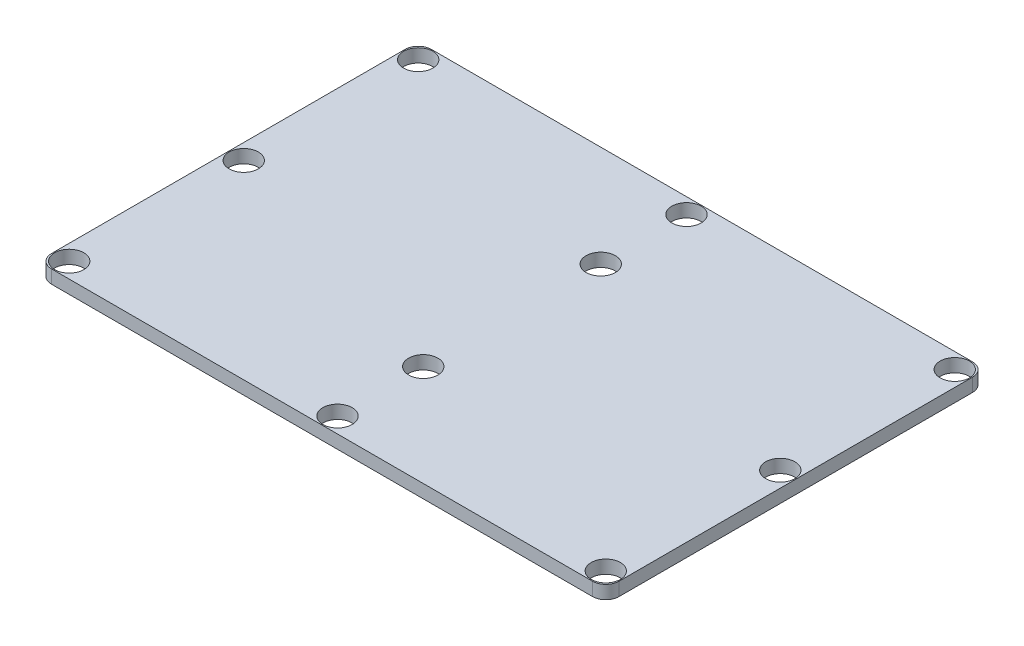
from build123d import *

# Parameters (mm, degrees)
SKETCH1_W            = 128
SKETCH1_H            = 85.7
BOSS_EXTRUDE1_DEPTH  = 3
M6_CLEARANCE_HOLE1_D = 6.6
FILLET1_R            = 3


with BuildPart() as part:
    # Sketch1 → Boss-Extrude1 (new body)
    with BuildSketch(Plane(origin=(0, 0, 0), x_dir=(1, 0, 0), z_dir=(0, 1, 0))):
        Rectangle(SKETCH1_W, SKETCH1_H)
    extrude(amount=BOSS_EXTRUDE1_DEPTH)

    # M6 Clearance Hole1 (through all)
    with Locations(Plane(origin=(0, 3, 0), x_dir=(1, 0, 0), z_dir=(0, 1, 0))):
        with Locations((-60.5, 39.35), (0, 39.35), (60.5, 39.35), (60.5, 0), (60.5, -39.35), (0, -39.35), (-60.5, -39.35), (-60.5, 0), (0, -20.01), (0, 20.01)):
            Hole(M6_CLEARANCE_HOLE1_D / 2)

    # Fillet1
    fillet1_edges = [part.edges().sort_by_distance(p)[0] for p in [
        (64, 1.5, 42.85),
        (-64, 1.5, 42.85),
        (-64, 1.5, -42.85),
        (64, 1.5, -42.85),
    ]]
    fillet(fillet1_edges, radius=FILLET1_R)


solid = part.part
